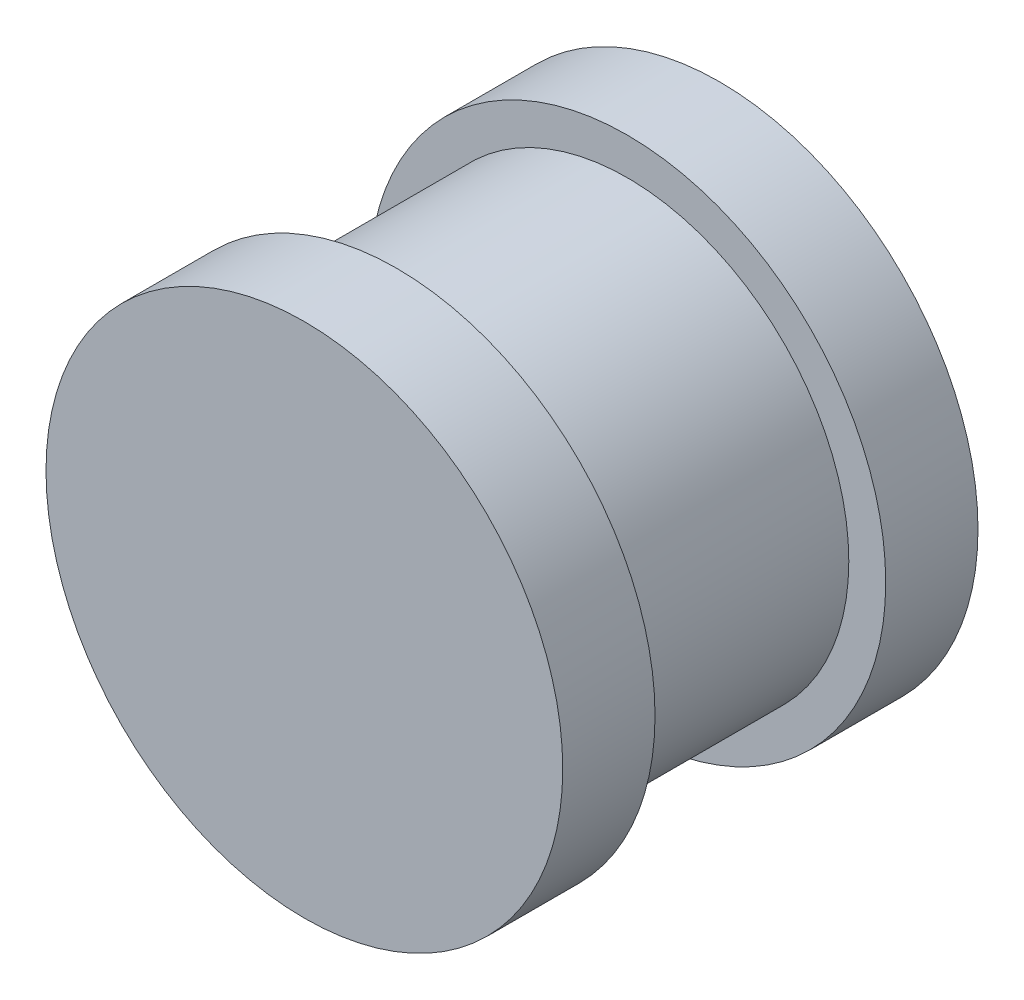
from build123d import *


with BuildPart() as part:
    # Sketch1 → Revolve1 (revolve)
    with BuildSketch(Plane(origin=(0, 0, 0), x_dir=(1, 0, 0), z_dir=(0, 1, 0))):
        Polygon((0, 0), (2.8, 0), (2.8, -1), (2.4, -1), (2.4, -3.5), (2.8, -3.5), (2.8, -4.5), (0, -4.5), align=None)
    revolve(axis=Axis((0, 0, 4.5), (0, 0, -1)))


solid = part.part
